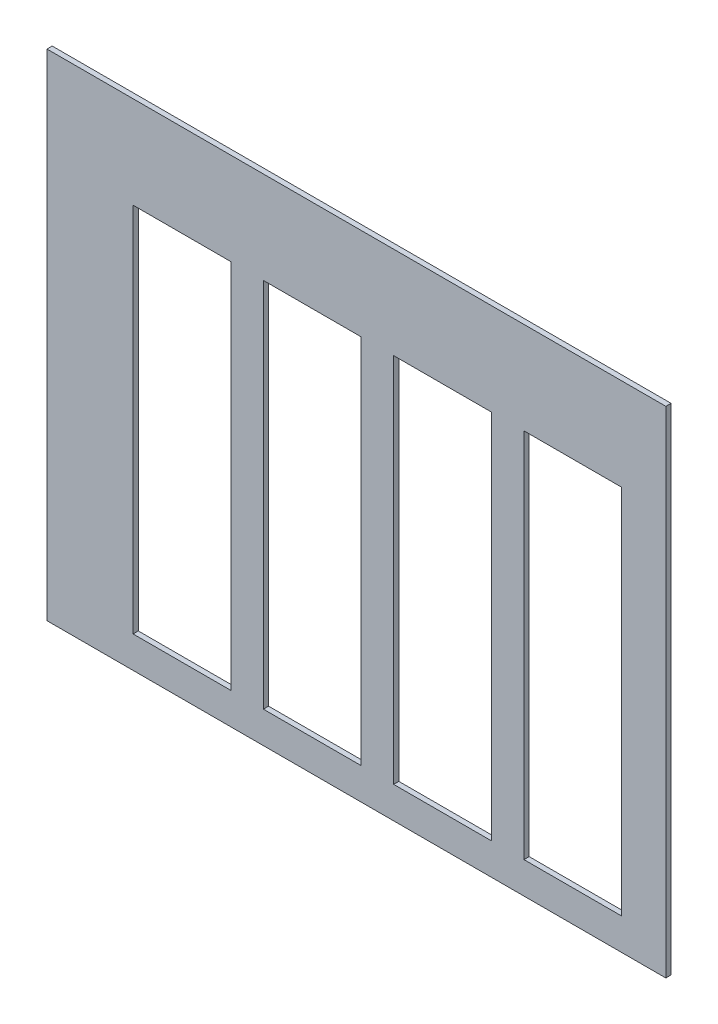
from build123d import *

# Parameters (mm, degrees)
SKETCH1_W           = 950
SKETCH1_H           = 760
SKETCH1_W_2         = 150
SKETCH1_H_2         = 570
BOSS_EXTRUDE1_DEPTH = 8


with BuildPart() as part:
    # Sketch1 → Boss-Extrude1 (new body)
    with BuildSketch(Plane.XY):
        with Locations((-250, -161.777108434)):
            Rectangle(SKETCH1_W, SKETCH1_H)
        with Locations((-317.817445786, -208.283894146)):
            Rectangle(SKETCH1_W_2, SKETCH1_H_2, mode=Mode.SUBTRACT)
        with Locations((-517.817445786, -208.283894146)):
            Rectangle(SKETCH1_W_2, SKETCH1_H_2, mode=Mode.SUBTRACT)
        with Locations((-117.817445786, -208.283894146)):
            Rectangle(SKETCH1_W_2, SKETCH1_H_2, mode=Mode.SUBTRACT)
        with Locations((82.182554214, -208.283894146)):
            Rectangle(SKETCH1_W_2, SKETCH1_H_2, mode=Mode.SUBTRACT)
    extrude(amount=BOSS_EXTRUDE1_DEPTH)


solid = part.part
